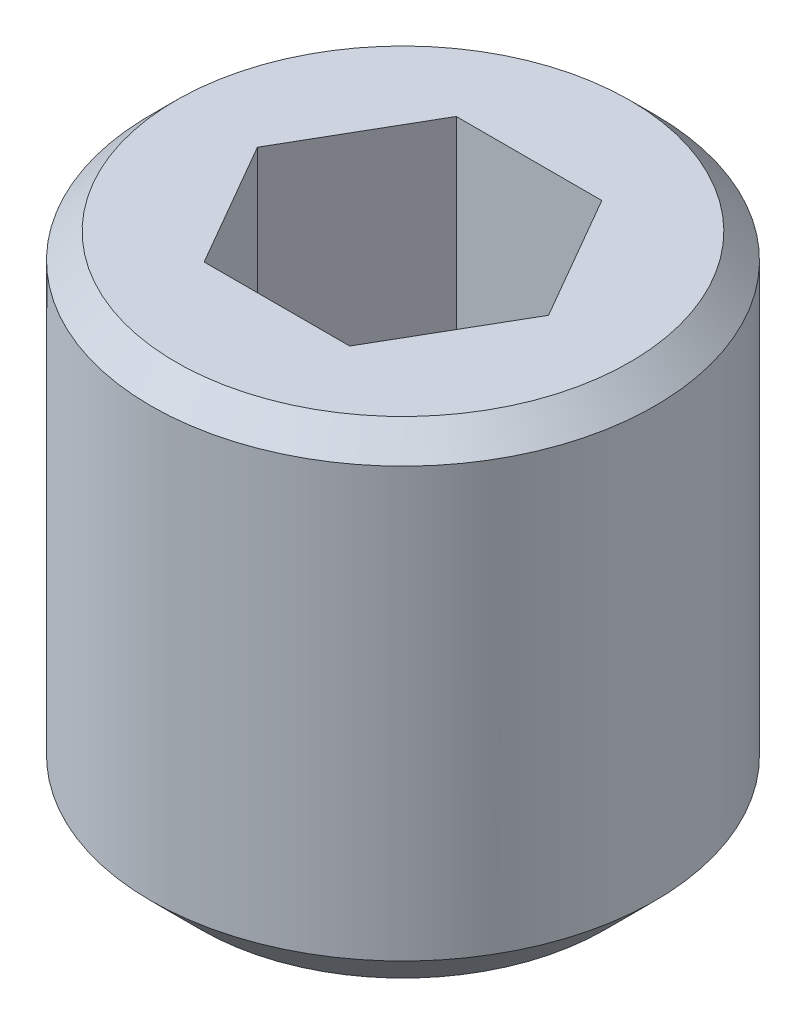
from build123d import *

# Parameters (mm, degrees)
CROQUIS1_W            = 1.5
CROQUIS1_H            = 3
CORTAR_EXTRUIR2_DEPTH = 1.5
CHAFL_N3_SIZE         = 0.3
CHAFL_N4_SIZE         = 0.15


with BuildPart() as part:
    # Croquis1 → Revolución1 (revolve)
    with BuildSketch(Plane.XY, mode=Mode.PRIVATE) as revoluci_n1_sk:
        with Locations((0.75, -1.5)):
            Rectangle(CROQUIS1_W, CROQUIS1_H)
    revolve(revoluci_n1_sk.sketch.rotate(Axis((0, 0, 0), (0, -1, 0)), 90), axis=Axis((0, 0, 0), (0, -1, 0)))

    # Croquis3 → Cortar-Extruir2 (cut)
    with BuildSketch(Plane(origin=(0, 0, 0), x_dir=(1, 0, 0), z_dir=(0, 1, 0))):
        Polygon((-0.433012702, 0.75), (-0.866025404, 0), (-0.433012702, -0.75), (0.433012702, -0.75), (0.866025404, 0), (0.433012702, 0.75), align=None)
    extrude(amount=-CORTAR_EXTRUIR2_DEPTH, mode=Mode.SUBTRACT)

    # Chaflán3
    chafl_n3_edges = [part.edges().sort_by_distance(p)[0] for p in [
        (0, -3, -1.5),
    ]]
    chamfer(chafl_n3_edges, length=CHAFL_N3_SIZE)

    # Chaflán4
    chafl_n4_edges = [part.edges().sort_by_distance(p)[0] for p in [
        (0, 0, -1.5),
    ]]
    chamfer(chafl_n4_edges, length=CHAFL_N4_SIZE)


solid = part.part
